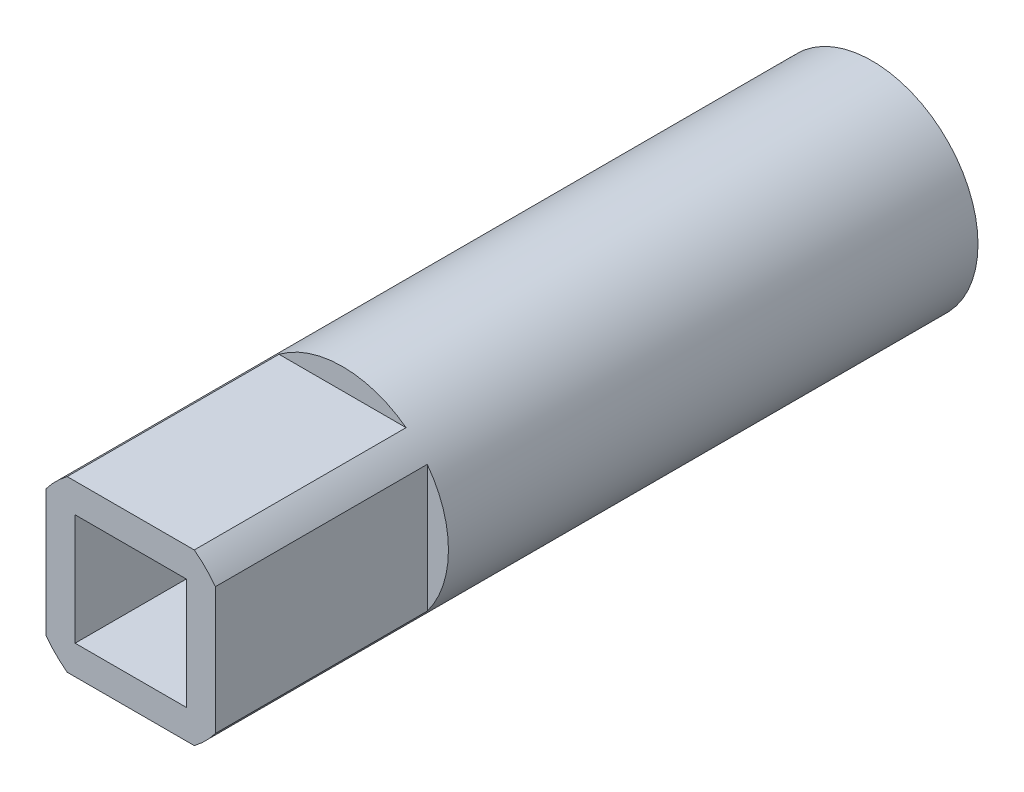
from build123d import *

# Parameters (mm, degrees)
SKETCH1_R           = 5
BOSS_EXTRUDE1_DEPTH = 25
CUT_EXTRUDE1_DEPTH  = 9.3
BOSS_EXTRUDE2_DEPTH = 10
SKETCH4_W           = 5.25
SKETCH4_H           = 5.25
CUT_EXTRUDE2_DEPTH  = 10


with BuildPart() as part:
    # Sketch1 → Boss-Extrude1 (new body)
    with BuildSketch(Plane.XY):
        Circle(SKETCH1_R)
    extrude(amount=BOSS_EXTRUDE1_DEPTH)

    # Sketch2 → Cut-Extrude1 (cut)
    with BuildSketch(Plane(origin=(0, 0, 0), x_dir=(-1, 0, 0), z_dir=(0, 0, -1))):
        with BuildLine():
            Line((-2.112335797, -1.727538634), (2.13030489, -1.727538634))
            ThreePointArc((2.13030489, -1.727538634), (2.758984546, 0.022461366), (2.13030489, 1.772461366))
            Line((2.13030489, 1.772461366), (-2.112335797, 1.772461366))
            ThreePointArc((-2.112335797, 1.772461366), (-2.741015454, 0.022461366), (-2.112335797, -1.727538634))
        make_face()
    extrude(amount=-CUT_EXTRUDE1_DEPTH, mode=Mode.SUBTRACT)

    # Sketch3 → Boss-Extrude2 (add)
    with BuildSketch(Plane.XY.offset(25)):
        with BuildLine():
            ThreePointArc((-4, -3), (-3.535533906, -3.535533906), (-3, -4))
            Line((-3, -4), (3, -4))
            ThreePointArc((3, -4), (3.535533906, -3.535533906), (4, -3))
            Line((4, -3), (4, 3))
            ThreePointArc((4, 3), (3.535533906, 3.535533906), (3, 4))
            Line((3, 4), (-3, 4))
            ThreePointArc((-3, 4), (-3.535533906, 3.535533906), (-4, 3))
            Line((-4, 3), (-4, -3))
        make_face()
    extrude(amount=BOSS_EXTRUDE2_DEPTH)

    # Sketch4 → Cut-Extrude2 (cut)
    with BuildSketch(Plane.XY.offset(35)):
        Rectangle(SKETCH4_W, SKETCH4_H)
    extrude(amount=-CUT_EXTRUDE2_DEPTH, mode=Mode.SUBTRACT)


solid = part.part
